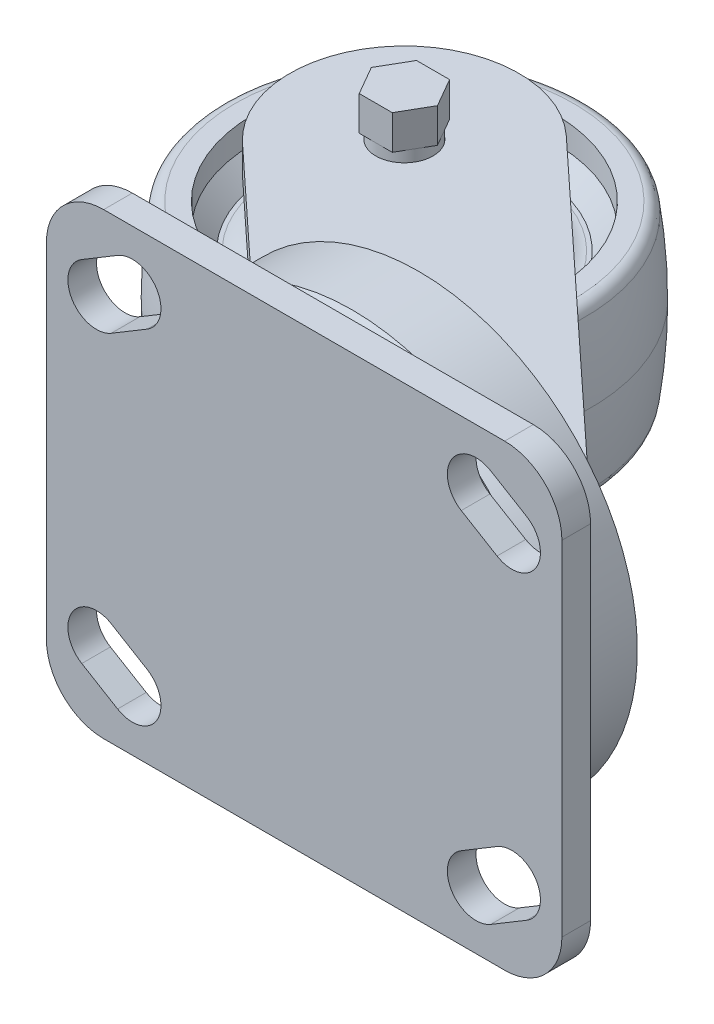
from build123d import *
from build123d.topology import SkipClean

# Parameters (mm, degrees)
FILLET4_R               = 2.54
CHAMFER1_SIZE           = 1.524
EXTRUDE1_DEPTH          = 6.35
SKETCH7_W               = 114.3
SKETCH7_H               = 6.35
EXTRUDE2_DEPTH          = 50.8
EXTRUDE8_DEPTH          = 6.35
EXTRUDE10_DEPTH         = 3.175
EXTRUDE3_DEPTH          = 11.176
CHAMFER2_SIZE           = 5.08
EXTRUDE4_DEPTH          = 11.43
CHAMFER3_SIZE           = 5.08
CUT_EXTRUDE1_DEPTH      = 6.35
FILLET1_R               = 12.7
CUT_EXTRUDE2_DEPTH      = 125.321729699
CUT_EXTRUDE2_DEPTH_BACK = 125.321729699
SKETCH11_R              = 6.35
SKETCH12_R              = 6.3246
EXTRUDE5_DEPTH          = 33.4645
EXTRUDE6_DEPTH          = 7.62
SKETCH26_R              = 50.8
SKETCH26_R_2            = 48.47388575
CUT_EXTRUDE3_DEPTH      = 17.78


with BuildPart() as part:
    # Sketch1 → Revolve1 (revolve)
    with BuildSketch(Plane.XY, mode=Mode.PRIVATE) as revolve1_sk:
        with BuildLine():
            Line((0, 0), (0, -23.8125))
            Line((0, -23.8125), (22.225, -23.8125))
            Line((22.225, -23.8125), (22.225, -15.875))
            ThreePointArc((22.225, -15.875), (24.084871939, -11.384871939), (28.575, -9.525))
            Line((28.575, -9.525), (29.455615818, -9.525))
            Line((29.455615818, -9.525), (33.401, -13.470384182))
            Line((33.401, -13.470384182), (33.401, -19.05))
            Line((33.401, -19.05), (39.751, -19.05))
            ThreePointArc((39.751, -19.05), (40.893392343, -9.555431387), (41.275, 0))
            Line((41.275, 0), (0, 0))
        make_face()
    revolve(revolve1_sk.sketch.rotate(Axis((0, 22.225, 0), (0, -1, 0)), 180), axis=Axis((0, 22.225, 0), (0, -1, 0)))

    # Fillet4
    fillet4_edges = [part.edges().sort_by_distance(p)[0] for p in [
        (39.751, -19.05, 0),
    ]]
    fillet(fillet4_edges, radius=FILLET4_R)

    # Chamfer1
    chamfer1_edges = [part.edges().sort_by_distance(p)[0] for p in [
        (22.225, -23.8125, 0),
    ]]
    chamfer(chamfer1_edges, length=CHAMFER1_SIZE)


with BuildPart() as body_2:
    # Sketch3 → Extrude1 (new body)
    with BuildSketch(Plane.XZ.offset(24.5745)):
        with BuildLine():
            Line((-17.283457924, 18.612954687), (7.121821644, 41.275))
            Line((7.121821644, 41.275), (81.778178356, 41.275))
            Line((81.778178356, 41.275), (17.283457924, -18.612954687))
            ThreePointArc((17.283457924, -18.612954687), (-18.612954687, -17.283457924), (-17.283457924, 18.612954687))
        make_face()
    extrude(amount=EXTRUDE1_DEPTH)

    # Sketch20 → Extrude8 (add)
    with BuildSketch(Plane.XY.offset(41.275)):
        with BuildLine():
            Line((-6.35, 0), (95.25, 0))
            ThreePointArc((95.25, 0), (44.45, -50.8), (-6.35, 0))
        make_face()
    extrude(amount=EXTRUDE8_DEPTH)

    # Sketch24 → Extrude10 (add)
    with BuildSketch(Plane(origin=(0, 0, 41.275), x_dir=(-1, 0, 0), z_dir=(0, 0, -1))):
        with BuildLine():
            Line((-57.15, 0), (-31.75, 0))
            ThreePointArc((-31.75, 0), (-44.45, -12.7), (-57.15, 0))
        make_face()
    extrude(amount=EXTRUDE10_DEPTH)

    # Sketch8 → Extrude3 (add)
    with BuildSketch(Plane.XY.offset(47.625)):
        with BuildLine():
            Line((-6.35, 0), (12.7, 0))
            ThreePointArc((12.7, 0), (44.45, -31.75), (76.2, 0))
            Line((76.2, 0), (95.25, 0))
            ThreePointArc((95.25, 0), (44.45, -50.8), (-6.35, 0))
        make_face()
    extrude(amount=EXTRUDE3_DEPTH)

    # Chamfer2
    chamfer2_edges = [body_2.edges().sort_by_distance(p)[0] for p in [
        (44.45, -50.8, 58.801),
    ]]
    chamfer(chamfer2_edges, length=CHAMFER2_SIZE)


with BuildPart() as body_3:
    # Sketch7 → Extrude2 (new body)
    with BuildSketch(Plane(origin=(0, 0, 0), x_dir=(1, 0, 0), z_dir=(0, 1, 0))):
        with Locations((44.45, -63.5)):
            Rectangle(SKETCH7_W, SKETCH7_H)
    extrude(amount=-EXTRUDE2_DEPTH)

    # Sketch9 → Extrude4 (add)
    with BuildSketch(Plane(origin=(0, 0, 60.325), x_dir=(-1, 0, 0), z_dir=(0, 0, -1))):
        with BuildLine():
            Line((-69.85, 0), (-50.8, 0))
            ThreePointArc((-50.8, 0), (-44.45, -6.35), (-38.1, 0))
            Line((-38.1, 0), (-19.05, 0))
            ThreePointArc((-19.05, 0), (-44.45, -25.4), (-69.85, 0))
        make_face()
    extrude(amount=EXTRUDE4_DEPTH)

    # Chamfer3
    chamfer3_edges = [body_3.edges().sort_by_distance(p)[0] for p in [
        (44.45, -6.35, 60.325),
    ]]
    chamfer(chamfer3_edges, length=CHAMFER3_SIZE)

    # Sketch10 → Cut-Extrude1 (cut)
    with BuildSketch(Plane.XY.offset(66.675)):
        with BuildLine():
            Line((1.679548047, -27.892419922), (9.617048047, -32.654919922))
            ThreePointArc((9.617048047, -32.654919922), (11.795080078, -41.367048047), (3.082951953, -43.545080078))
            Line((3.082951953, -43.545080078), (-4.854548047, -38.782580078))
            ThreePointArc((-4.854548047, -38.782580078), (-7.032580078, -30.070451953), (1.679548047, -27.892419922))
        make_face()
        with BuildLine():
            Line((85.817048047, -43.545080078), (93.754548047, -38.782580078))
            ThreePointArc((93.754548047, -38.782580078), (95.932580078, -30.070451953), (87.220451953, -27.892419922))
            Line((87.220451953, -27.892419922), (79.282951953, -32.654919922))
            ThreePointArc((79.282951953, -32.654919922), (77.104919922, -41.367048047), (85.817048047, -43.545080078))
        make_face()
    extrude(amount=-CUT_EXTRUDE1_DEPTH, mode=Mode.SUBTRACT)

    # Fillet1
    fillet1_edges = [body_3.edges().sort_by_distance(p)[0] for p in [
        (101.6, -50.8, 63.5),
        (-12.7, -50.8, 63.5),
    ]]
    fillet(fillet1_edges, radius=FILLET1_R)

    # Mirror1: body 3 across plane


with BuildPart() as cut_extrude2_tool:
    # Sketch11 → Cut-Extrude2 (new, two sides: drawn at the far end of the back side and taken through both)
    with BuildSketch(Plane(origin=(0, -24.5745, 0), x_dir=(-1, 0, 0), z_dir=(0, 1, 0)).offset(-CUT_EXTRUDE2_DEPTH_BACK)):
        with Locations(Location((0, 0, 0), (0, 0, 180))):
            Circle(SKETCH11_R)
    extrude(amount=CUT_EXTRUDE2_DEPTH + CUT_EXTRUDE2_DEPTH_BACK)


with BuildPart() as part_1:
    add(part.part)

    # Cut-Extrude2: cut by cut_extrude2_tool
    add(cut_extrude2_tool.part, mode=Mode.SUBTRACT)

    # Mirror1 2: part across plane


with BuildPart() as body_2_1:
    add(body_2.part)

    # Cut-Extrude2: cut by cut_extrude2_tool
    add(cut_extrude2_tool.part, mode=Mode.SUBTRACT)

    # Mirror1 3: body 2 across plane


with BuildPart() as body_4:
    # Sketch12 → Extrude5 (new body)
    with BuildSketch(Plane(origin=(0, 0, 0), x_dir=(-1, 0, 0), z_dir=(0, 1, 0))):
        with Locations(Location((0, 0, 0), (0, 0, 90))):
            Circle(SKETCH12_R)
    extrude(amount=-EXTRUDE5_DEPTH)

    # Sketch13 → Extrude6 (add)
    with BuildSketch(Plane.XZ.offset(33.4645)):
        Polygon((3.666174209, 6.35), (-3.666174209, 6.35), (-7.332348419, 0), (-3.666174209, -6.35), (3.666174209, -6.35), (7.332348419, 0), align=None)
    extrude(amount=EXTRUDE6_DEPTH)

    # Mirror1 4: body 4 across plane


with BuildPart() as body_3_1:
    add(body_3.part)
    add(body_3.part.mirror(Plane.ZX))


with BuildPart() as part_2:
    add(part_1.part)
    add(part_1.part.mirror(Plane.ZX))


with BuildPart() as body_2_2:
    with SkipClean():  # the faces are left unmerged after this step: merging them gives an invalid solid
        add(body_2_1.part)
        add(body_2_1.part.mirror(Plane.ZX))

    # Sketch26 → Cut-Extrude3 (cut)
    with SkipClean():  # the faces are left unmerged after this step: merging them gives an invalid solid
        with BuildSketch(Plane(origin=(0, 0, 41.275), x_dir=(-1, 0, 0), z_dir=(0, 0, -1))):
            with Locations((-44.45, 0)):
                Circle(SKETCH26_R)
            with Locations((-44.45, 0)):
                Circle(SKETCH26_R_2, mode=Mode.SUBTRACT)
        extrude(amount=-CUT_EXTRUDE3_DEPTH, mode=Mode.SUBTRACT)


with BuildPart() as body_4_1:
    add(body_4.part)
    add(body_4.part.mirror(Plane.ZX))


solid = Compound([body_3_1.part, part_2.part, body_2_2.part, body_4_1.part])
